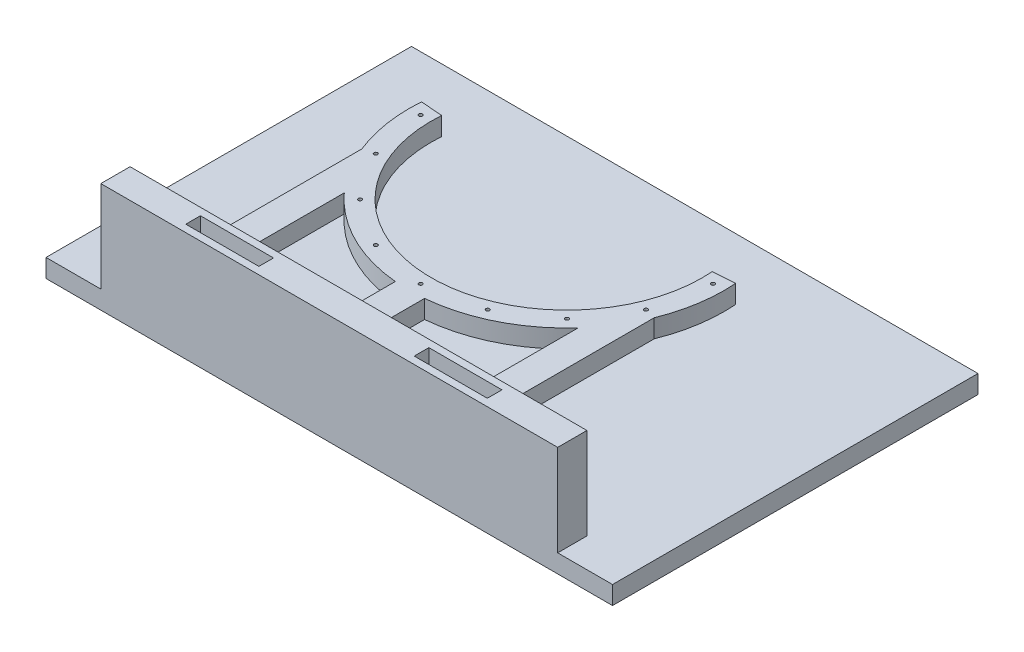
from build123d import *

# Parameters (mm, degrees)
SKETCH_1_W               = 155
SKETCH_1_H               = 100
EXTRUDE_1_DEPTH          = 5
SKETCH_2_W               = 125
SKETCH_2_H               = 8
EXTRUDE_2_DEPTH          = 25
EXTRUDE_6_DEPTH          = 20
EXTRUDE_7_REACH          = 184.727
EXTRUDE_7_END_RADIUS     = 43.11234224
SKETCH_11_W              = 8
SKETCH_11_H              = 5
SKETCH_12_W              = 125
SKETCH_12_H              = 15
CUT_EXTRUDE_1_DEPTH      = 130
PATTERN_CIRCULAR_1_COUNT = 5
PATTERN_CIRCULAR_1_ANGLE = 90
F_1_THE_OTHER_WAY_COUNT  = 5
F_1_THE_OTHER_WAY_ANGLE  = 90
CUT_EXTRUDE_2_REACH      = 188.145
CUT_EXTRUDE_2_END_RADIUS = 3
SKETCH_17_R              = 0.5
PATTERN_CIRCULAR_2_COUNT = 9
PATTERN_CIRCULAR_2_ANGLE = 180
SKETCH_19_W              = 20
SKETCH_19_H              = 4
CUT_EXTRUDE_3_DEPTH      = 15


with BuildPart() as part:
    # 草图1 → 凸台-拉伸1 (new body)
    with BuildSketch(Plane(origin=(0, 0, 0), x_dir=(1, 0, 0), z_dir=(0, 1, 0))):
        with Locations((77.5, 50)):
            Rectangle(SKETCH_1_W, SKETCH_1_H)
    extrude(amount=EXTRUDE_1_DEPTH)

    # 草图2 → 凸台-拉伸2 (add)
    with BuildSketch(Plane(origin=(0, 5, 0), x_dir=(1, 0, 0), z_dir=(0, 1, 0))):
        with Locations((77.5, 4)):
            Rectangle(SKETCH_2_W, SKETCH_2_H)
    extrude(amount=EXTRUDE_2_DEPTH)

    # 草图7 → 凸台-拉伸6 (add)
    with BuildSketch(Plane(origin=(0, 5, 0), x_dir=(1, 0, 0), z_dir=(0, 1, 0))):
        with BuildLine():
            Line((34.50840207, 68.224369845), (40.49159793, 67.775630155))
            ThreePointArc((40.49159793, 67.775630155), (77.5, 27.88765776), (114.50840207, 67.775630155))
            Line((114.50840207, 67.775630155), (120.49159793, 68.224369845))
            ThreePointArc((120.49159793, 68.224369845), (77.5, 21.88765776), (34.50840207, 68.224369845))
        make_face()
    extrude(amount=EXTRUDE_6_DEPTH)

    # 凸台-拉伸7: up to this cylinder (the profile starts outside it)
    extrude_7_end = Plane(origin=(77.5, 22.5, -65), z_dir=(0, -1, 0)) * Cylinder(EXTRUDE_7_END_RADIUS, 456.67868448, mode=Mode.PRIVATE)
    # 草图11 → 凸台-拉伸7 (add, up to the surface)
    with BuildSketch(Plane(origin=(0, 0, -8), x_dir=(-1, 0, 0), z_dir=(0, 0, -1)), mode=Mode.PRIVATE) as extrude_7_sk1:
        with Locations((-77.5, 22.5)):
            Rectangle(SKETCH_11_W, SKETCH_11_H)
    extrude_7_tool1 = extrude(extrude_7_sk1.sketch, amount=EXTRUDE_7_REACH, mode=Mode.PRIVATE) - extrude_7_end
    add(extrude_7_tool1.solids().sort_by_distance((77.5, 22.5, -8))[0])
    # 草图11 → 凸台-拉伸7 (add, up to the surface)
    with BuildSketch(Plane(origin=(0, 0, -8), x_dir=(-1, 0, 0), z_dir=(0, 0, -1)), mode=Mode.PRIVATE) as extrude_7_sk2:
        with Locations((-41.5, 22.5)):
            Rectangle(SKETCH_11_W, SKETCH_11_H)
    extrude_7_tool2 = extrude(extrude_7_sk2.sketch, amount=EXTRUDE_7_REACH, mode=Mode.PRIVATE) - extrude_7_end
    add(extrude_7_tool2.solids().sort_by_distance((41.5, 22.5, -8))[0])
    # 草图11 → 凸台-拉伸7 (add, up to the surface)
    with BuildSketch(Plane(origin=(0, 0, -8), x_dir=(-1, 0, 0), z_dir=(0, 0, -1)), mode=Mode.PRIVATE) as extrude_7_sk3:
        with Locations((-113.5, 22.5)):
            Rectangle(SKETCH_11_W, SKETCH_11_H)
    extrude_7_tool3 = extrude(extrude_7_sk3.sketch, amount=EXTRUDE_7_REACH, mode=Mode.PRIVATE) - extrude_7_end
    add(extrude_7_tool3.solids().sort_by_distance((113.5, 22.5, -8))[0])

    # 草图12 → 切除-拉伸1 (cut)
    with BuildSketch(Plane(origin=(0, 0, -8), x_dir=(-1, 0, 0), z_dir=(0, 0, -1))):
        with Locations((-77.5, 12.5)):
            Rectangle(SKETCH_12_W, SKETCH_12_H)
    extrude(amount=CUT_EXTRUDE_1_DEPTH, mode=Mode.SUBTRACT)

    # 草图16 → 切除-旋转3 (revolve, cut)
    with BuildSketch(Plane(origin=(0, 18, 0), x_dir=(-1, 0, 0), z_dir=(0, -1, 0))):
        with BuildLine():
            Line((-80.5, 25), (-74.5, 25))
            ThreePointArc((-74.5, 25), (-77.5, 22), (-80.5, 25))
        make_face()
    cut_revolve_3 = revolve(axis=Axis((74.5, 18, -25), (1, 0, 0)), mode=Mode.SUBTRACT)

    # 阵列(圆周)1: 切除-旋转3 ×5 about axis
    pattern_circular_1_axis = Axis((77.5, 0, -65), (0, -1, 0))
    for i in range(1, PATTERN_CIRCULAR_1_COUNT):
        add(cut_revolve_3.rotate(pattern_circular_1_axis, i * PATTERN_CIRCULAR_1_ANGLE / (PATTERN_CIRCULAR_1_COUNT - 1)), mode=Mode.SUBTRACT)

    # 1 the other way: 切除-旋转3 ×5 about axis
    f_1_the_other_way_axis = Axis((77.5, 0, -65), (0, 1, 0))
    for i in range(1, F_1_THE_OTHER_WAY_COUNT):
        add(cut_revolve_3.rotate(f_1_the_other_way_axis, i * F_1_THE_OTHER_WAY_ANGLE / (F_1_THE_OTHER_WAY_COUNT - 1)), mode=Mode.SUBTRACT)

    # 切除-拉伸2: up to this sphere (the profile starts outside it)
    cut_extrude_2_end = Location((37.5, 18, -65)) * Sphere(CUT_EXTRUDE_2_END_RADIUS, mode=Mode.PRIVATE)
    # 草图17 → 切除-拉伸2 (cut, up to the surface)
    with BuildSketch(Plane(origin=(0, 25, 0), x_dir=(1, 0, 0), z_dir=(0, 1, 0)), mode=Mode.PRIVATE) as cut_extrude_2_sk1:
        with Locations(Location((37.5, 64.994842405, 0), (0, 0, 270))):
            Circle(SKETCH_17_R)
    cut_extrude_2_tool1 = extrude(cut_extrude_2_sk1.sketch, amount=-CUT_EXTRUDE_2_REACH, mode=Mode.PRIVATE) - cut_extrude_2_end
    cut_extrude_2 = cut_extrude_2_tool1.solids().sort_by_distance((37.5, 25, -64.994842))[0]
    add(cut_extrude_2, mode=Mode.SUBTRACT)

    # 阵列(圆周)2: 切除-拉伸2 ×9 about axis
    pattern_circular_2_axis = Axis((77.5, 0, -65), (0, 1, 0))
    for i in range(1, PATTERN_CIRCULAR_2_COUNT):
        add(cut_extrude_2.rotate(pattern_circular_2_axis, i * PATTERN_CIRCULAR_2_ANGLE / (PATTERN_CIRCULAR_2_COUNT - 1)), mode=Mode.SUBTRACT)

    # 草图19 → 切除-拉伸3 (cut)
    with BuildSketch(Plane(origin=(0, 30, 0), x_dir=(1, 0, 0), z_dir=(0, 1, 0))):
        with Locations((46.25, 4)):
            Rectangle(SKETCH_19_W, SKETCH_19_H)
        with Locations((108.75, 4)):
            Rectangle(SKETCH_19_W, SKETCH_19_H)
    extrude(amount=-CUT_EXTRUDE_3_DEPTH, mode=Mode.SUBTRACT)


solid = part.part
